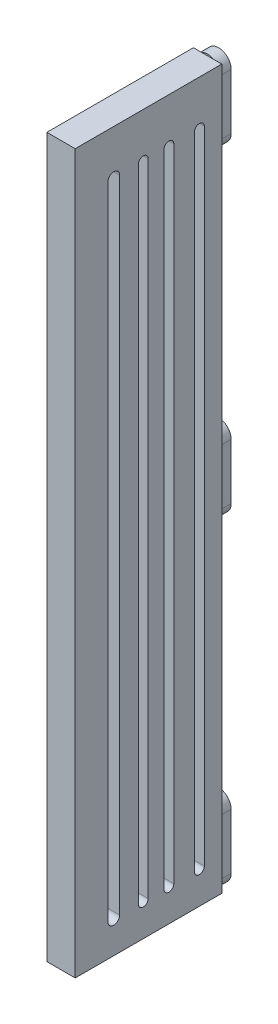
from build123d import *

# Parameters (mm, degrees)
SKETCH1_W           = 3.867553816
SKETCH1_H           = 98
BOSS_EXTRUDE3_DEPTH = 20
BOSS_EXTRUDE4_DEPTH = 1.5
CUT_EXTRUDE1_DEPTH  = 54.264192452


with BuildPart() as part:
    # Sketch1 → Boss-Extrude3 (new body)
    with BuildSketch(Plane.XY):
        Rectangle(SKETCH1_W, SKETCH1_H)
    extrude(amount=BOSS_EXTRUDE3_DEPTH)

    # Sketch1<6> → Boss-Extrude4 (add)
    with BuildSketch(Plane.XY):
        with BuildLine():
            Line((1.71, 3.795), (1.71, -3.795))
            ThreePointArc((1.71, -3.795), (0, -5.505), (-1.71, -3.795))
            Line((-1.71, -3.795), (-1.71, 3.795))
            ThreePointArc((-1.71, 3.795), (0, 5.505), (1.71, 3.795))
        make_face()
        with BuildLine():
            Line((1.71, -39.915), (1.71, -47.505))
            ThreePointArc((1.71, -47.505), (0, -49.215), (-1.71, -47.505))
            Line((-1.71, -47.505), (-1.71, -39.915))
            ThreePointArc((-1.71, -39.915), (0, -38.205), (1.71, -39.915))
        make_face()
        with BuildLine():
            Line((1.71, 47.505), (1.71, 39.915))
            ThreePointArc((1.71, 39.915), (0, 38.205), (-1.71, 39.915))
            Line((-1.71, 39.915), (-1.71, 47.505))
            ThreePointArc((-1.71, 47.505), (0, 49.215), (1.71, 47.505))
        make_face()
    extrude(amount=-BOSS_EXTRUDE4_DEPTH)

    # Sketch5 → Cut-Extrude1 (cut, through all)
    with BuildSketch(Plane(origin=(1.933776908, 0, 0), x_dir=(0, 0, -1), z_dir=(1, 0, 0))):
        with BuildLine():
            Line((-13.934698867, 42.838530115), (-13.934698867, -44.584300935))
            ThreePointArc((-13.934698867, -44.584300935), (-14.740439245, -45.390041313), (-15.546179624, -44.584300935))
            Line((-15.546179624, -44.584300935), (-15.546179624, 42.838530115))
            ThreePointArc((-15.546179624, 42.838530115), (-14.740439245, 43.644270494), (-13.934698867, 42.838530115))
        make_face()
        with BuildLine():
            Line((-10.040287038, 42.838530115), (-10.040287038, -44.584300935))
            ThreePointArc((-10.040287038, -44.584300935), (-10.711737354, -45.25575125), (-11.383187669, -44.584300935))
            Line((-11.383187669, -44.584300935), (-11.383187669, 42.838530115))
            ThreePointArc((-11.383187669, 42.838530115), (-10.711737354, 43.509980431), (-10.040287038, 42.838530115))
        make_face()
        with BuildLine():
            Line((-6.548745399, 42.838530115), (-6.548745399, -44.584300935))
            ThreePointArc((-6.548745399, -44.584300935), (-7.220195714, -45.25575125), (-7.891646029, -44.584300935))
            Line((-7.891646029, -44.584300935), (-7.891646029, 42.838530115))
            ThreePointArc((-7.891646029, 42.838530115), (-7.220195714, 43.509980431), (-6.548745399, 42.838530115))
        make_face()
        with BuildLine():
            Line((-2.385753444, 42.838530115), (-2.385753444, -44.584300935))
            ThreePointArc((-2.385753444, -44.584300935), (-3.057203759, -45.25575125), (-3.728654075, -44.584300935))
            Line((-3.728654075, -44.584300935), (-3.728654075, 42.838530115))
            ThreePointArc((-3.728654075, 42.838530115), (-3.057203759, 43.509980431), (-2.385753444, 42.838530115))
        make_face()
    extrude(amount=-CUT_EXTRUDE1_DEPTH, mode=Mode.SUBTRACT)


solid = part.part
